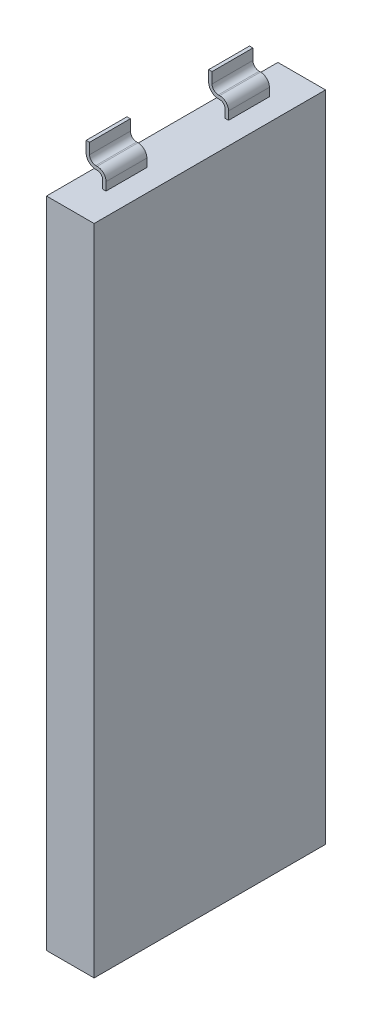
from build123d import *

# Parameters (mm, degrees)
SKETCH_1_W      = 34
SKETCH_1_H      = 96
EXTRUDE_1_DEPTH = 7
EXTRUDE_2_DEPTH = 3


with BuildPart() as part:
    # 草图1 → 凸台-拉伸1 (new body)
    with BuildSketch(Plane(origin=(0, 0, 0), x_dir=(0, 0, -1), z_dir=(1, 0, 0))):
        Rectangle(SKETCH_1_W, SKETCH_1_H)
    extrude(amount=EXTRUDE_1_DEPTH)

    # 草图2 → 凸台-拉伸2 (add, symmetric)
    with BuildSketch(Plane.XY.offset(9)):
        with BuildLine():
            Line((3.25, 48), (3.25, 49.2))
            ThreePointArc((3.25, 49.2), (3.015685425, 49.765685425), (2.45, 50))
            Line((2.45, 50), (2.25, 50))
            ThreePointArc((2.25, 50), (1.245908371, 50.415908371), (0.83, 51.42))
            Line((0.83, 51.42), (0.83, 53))
            Line((0.83, 53), (1.33, 53))
            Line((1.33, 53), (1.33, 51.42))
            ThreePointArc((1.33, 51.42), (1.599461761, 50.769461761), (2.25, 50.5))
            Line((2.25, 50.5), (2.45, 50.5))
            ThreePointArc((2.45, 50.5), (3.369238816, 50.119238816), (3.75, 49.2))
            Line((3.75, 49.2), (3.75, 48))
            Line((3.75, 48), (3.25, 48))
        make_face()
    extrude_2 = extrude(amount=EXTRUDE_2_DEPTH, both=True)

    # 镜向1: 凸台-拉伸2 across plane
    add(extrude_2.mirror(Plane.XY))


solid = part.part
